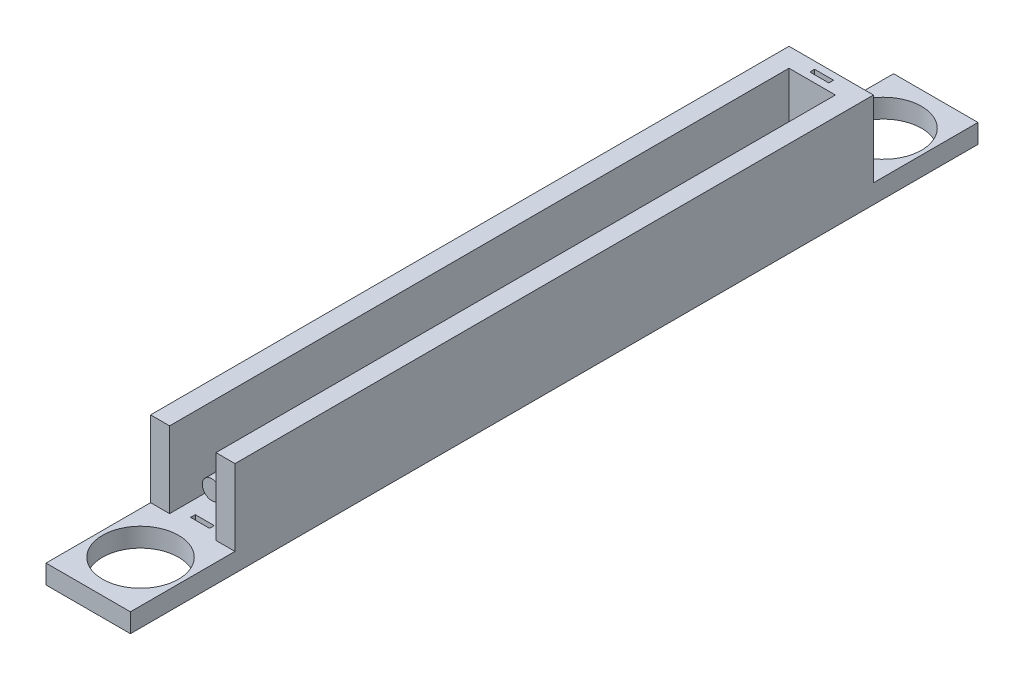
from build123d import *

# Parameters (mm, degrees)
SZKIC1_W                    = 4.44
SZKIC1_H                    = 33.58
DODANIE_WYCI_GNI_CIE1_DEPTH = 1
DODANIE_WYCI_GNI_CIE2_DEPTH = 4
SZKIC3_R                    = 0.5
DODANIE_WYCI_GNI_CIE3_DEPTH = 31.58
SZKIC4_W                    = 1
SZKIC4_H                    = 0.25
WYTNIJ_WYCI_GNI_CIE1_DEPTH  = 31.58
SZKIC5_W                    = 1
SZKIC5_H                    = 0.25
WYTNIJ_WYCI_GNI_CIE2_DEPTH  = 1
SZKIC6_W                    = 4.44
SZKIC6_H                    = 1
DODANIE_WYCI_GNI_CIE5_DEPTH = 5.5
SZKIC8_R                    = 2
WYTNIJ_WYCI_GNI_CIE3_DEPTH  = 5.5
SZKIC9_W                    = 4.44
SZKIC9_H                    = 1
DODANIE_WYCI_GNI_CIE6_DEPTH = 5.5
SZKIC11_R                   = 2
WYTNIJ_WYCI_GNI_CIE4_DEPTH  = 5.5


with BuildPart() as part:
    # Szkic1 → Dodanie-wyciągnięcie1 (new body)
    with BuildSketch(Plane(origin=(0, 0, 0), x_dir=(1, 0, 0), z_dir=(0, 1, 0))):
        Rectangle(SZKIC1_W, SZKIC1_H)
    extrude(amount=DODANIE_WYCI_GNI_CIE1_DEPTH)

    # Szkic2 → Dodanie-wyciągnięcie2 (add)
    with BuildSketch(Plane(origin=(0, 1, 0), x_dir=(1, 0, 0), z_dir=(0, 1, 0))):
        Polygon((-2.22, 16.79), (-2.22, -16.79), (-1.22, -16.79), (-1.22, 15.79), (1.22, 15.79), (1.22, -16.79), (2.22, -16.79), (2.22, 16.79), align=None)
    extrude(amount=DODANIE_WYCI_GNI_CIE2_DEPTH)

    # Szkic3 → Dodanie-wyciągnięcie3 (add)
    with BuildSketch(Plane.XY.offset(-15.79)):
        with Locations(Location((0, 2.2, 0), (0, 0, 180))):
            Circle(SZKIC3_R)
    extrude(amount=DODANIE_WYCI_GNI_CIE3_DEPTH)

    # Szkic4 → Wytnij-wyciągnięcie1 (cut)
    with BuildSketch(Plane(origin=(0, 1, 0), x_dir=(1, 0, 0), z_dir=(0, 1, 0))):
        with Locations((0, -16.283529096)):
            Rectangle(SZKIC4_W, SZKIC4_H)
    extrude(amount=-WYTNIJ_WYCI_GNI_CIE1_DEPTH, mode=Mode.SUBTRACT)

    # Szkic5 → Wytnij-wyciągnięcie2 (cut)
    with BuildSketch(Plane(origin=(0, 5, 0), x_dir=(1, 0, 0), z_dir=(0, 1, 0))):
        with Locations((0, 16.29)):
            Rectangle(SZKIC5_W, SZKIC5_H)
    extrude(amount=-WYTNIJ_WYCI_GNI_CIE2_DEPTH, mode=Mode.SUBTRACT)

    # Szkic6 → Dodanie-wyciągnięcie5 (add)
    with BuildSketch(Plane.XY.offset(16.79)):
        with Locations((0, 0.5)):
            Rectangle(SZKIC6_W, SZKIC6_H)
    extrude(amount=DODANIE_WYCI_GNI_CIE5_DEPTH)

    # Szkic8 → Wytnij-wyciągnięcie3 (cut)
    with BuildSketch(Plane(origin=(0, 1, 0), x_dir=(1, 0, 0), z_dir=(0, 1, 0))):
        with Locations(Location((0, -19.539171246, 0), (0, 0, 270))):
            Circle(SZKIC8_R)
    extrude(amount=-WYTNIJ_WYCI_GNI_CIE3_DEPTH, mode=Mode.SUBTRACT)

    # Szkic9 → Dodanie-wyciągnięcie6 (add)
    with BuildSketch(Plane(origin=(0, 0, -16.79), x_dir=(-1, 0, 0), z_dir=(0, 0, -1))):
        with Locations((0, 0.5)):
            Rectangle(SZKIC9_W, SZKIC9_H)
    extrude(amount=DODANIE_WYCI_GNI_CIE6_DEPTH)

    # Szkic11 → Wytnij-wyciągnięcie4 (cut)
    with BuildSketch(Plane(origin=(0, 1, 0), x_dir=(1, 0, 0), z_dir=(0, 1, 0))):
        with Locations(Location((0, 19.54, 0), (0, 0, 270))):
            Circle(SZKIC11_R)
    extrude(amount=-WYTNIJ_WYCI_GNI_CIE4_DEPTH, mode=Mode.SUBTRACT)


solid = part.part
